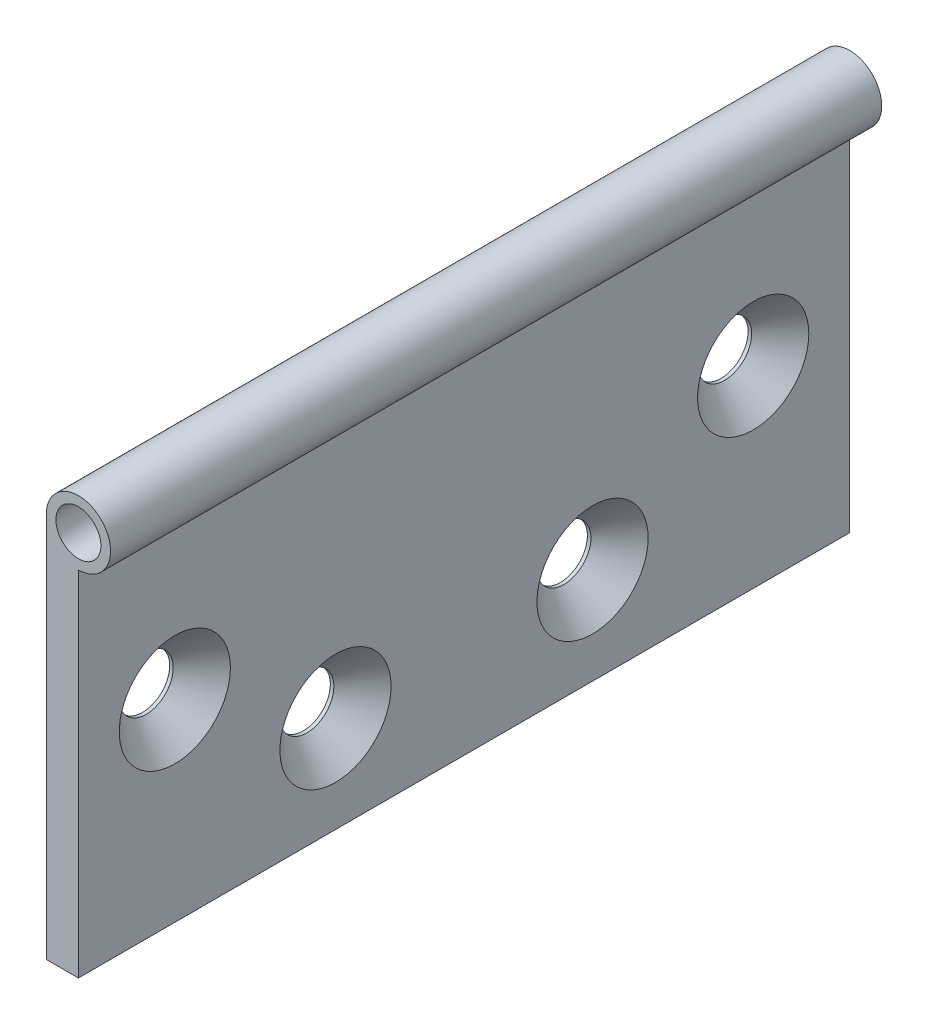
from build123d import *

# Parameters (mm, degrees)
SKETCH2_W                                      = 5
SKETCH2_H                                      = 60
EXTRUDE_THIN1_DEPTH                            = 60
SKETCH3_R                                      = 5
SKETCH4_R                                      = 3.5
CUT_EXTRUDE1_DEPTH                             = 137.839321834
CSK_FOR_M8_FLAT_HEAD_MACHINE_SCREW1_AT_2_COUNT = 2
CSK_FOR_M8_FLAT_HEAD_MACHINE_SCREW1_AT_2_PITCH = 29.154759474


with BuildPart() as part:
    # Sketch2 → Extrude-Thin1 (new, symmetric)
    with BuildSketch(Plane.XY):
        with Locations((2.5, 30)):
            Rectangle(SKETCH2_W, SKETCH2_H)
    extrude(amount=EXTRUDE_THIN1_DEPTH, both=True)

    # Sweep1: sweep along a curve in space
    with BuildLine() as sweep1_path:
        Line((5, 60, 60), (5, 60, -60))
    # Sketch3 → Sweep1 (sweep)
    with BuildSketch(Plane.XY.offset(60)):
        with Locations((5, 60)):
            Circle(SKETCH3_R)
    sweep(path=sweep1_path.line)

    # Sketch4 → Cut-Extrude1 (cut, through all)
    with BuildSketch(Plane.XY.offset(60)):
        with Locations((5, 60)):
            Circle(SKETCH4_R)
    extrude(amount=-CUT_EXTRUDE1_DEPTH, mode=Mode.SUBTRACT)

    # Sketch6 → CSK for M8 Flat Head Machine Screw1 (revolve, cut)
    with BuildSketch(Plane(origin=(5, 15, 20), x_dir=(0, 0, -1), z_dir=(0, 1, 0))):
        Polygon((0, 0), (0, 5), (4.2, 5), (4.2, 4.45), (8.65, 0), align=None)
    csk_for_m8_flat_head_machine_screw1 = revolve(axis=Axis((11.35, 15, 20), (-1, 0, 0)), mode=Mode.SUBTRACT)

    # CSK for M8 Flat Head Machine Screw1 at 2: CSK for M8 Flat Head Machine Screw1 ×2
    with Locations(*[Vector(0, 0.5144957554275265, 0.8574929257125442) * (i * CSK_FOR_M8_FLAT_HEAD_MACHINE_SCREW1_AT_2_PITCH) for i in range(1, CSK_FOR_M8_FLAT_HEAD_MACHINE_SCREW1_AT_2_COUNT)]):
        add(csk_for_m8_flat_head_machine_screw1, mode=Mode.SUBTRACT)

    # Mirror1: CSK for M8 Flat Head Machine Screw1 across plane
    add(csk_for_m8_flat_head_machine_screw1.mirror(Plane.XY), mode=Mode.SUBTRACT)

    # Mirror1 copy 1 sketch → Mirror1 copy 1 (revolve, cut)
    with BuildSketch(Plane(origin=(5, 30, -45), x_dir=(0, 0, 1), z_dir=(0, 1, 0))):
        Polygon((0, 0), (0, -5), (4.2, -5), (4.2, -4.45), (8.65, 0), align=None)
    revolve(axis=Axis((11.35, 30, -45), (1, 0, 0)), mode=Mode.SUBTRACT)


solid = part.part
